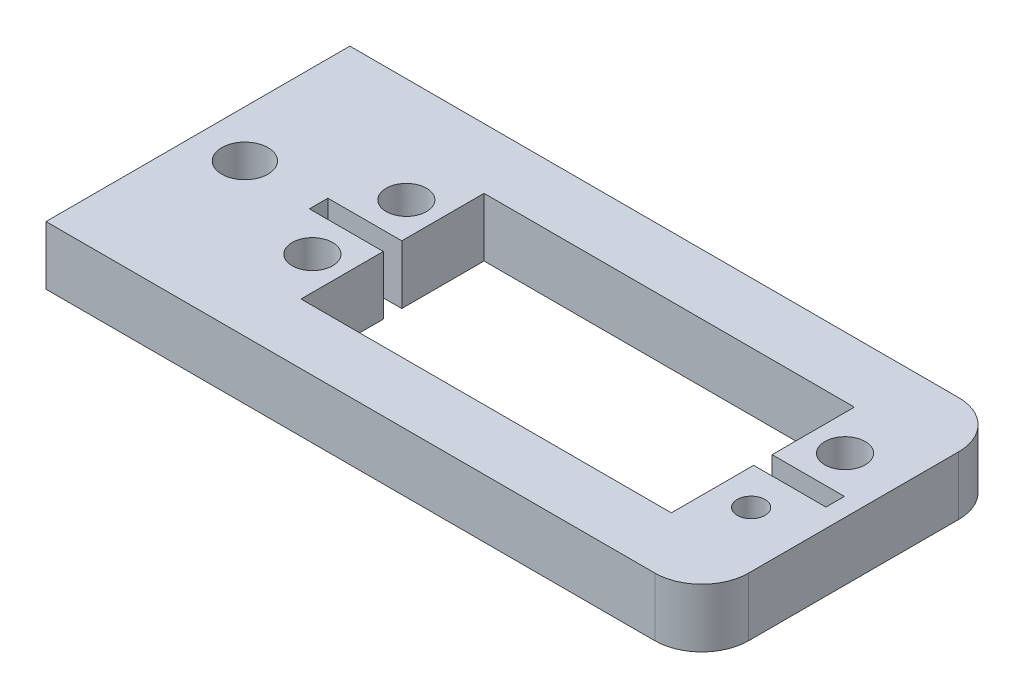
from build123d import *

# Parameters (mm, degrees)
SKETCH1_R           = 2.19
SKETCH1_R_2         = 2.5
SKETCH1_R_3         = 1.5
BOSS_EXTRUDE1_DEPTH = 6.35


with BuildPart() as part:
    # Sketch1 → Boss-Extrude1 (new body)
    with BuildSketch(Plane(origin=(0, 0, 0), x_dir=(1, 0, 0), z_dir=(0, 1, 0))):
        with BuildLine():
            Line((-9.153018436, -1.431925443), (-66.073018436, -1.431925443))
            Line((-66.073018436, -1.431925443), (-75.073018436, -1.431925443))
            Line((-75.073018436, -1.431925443), (-75.073018436, -6.511925443))
            Line((-75.073018436, -6.511925443), (-75.073018436, -29.251925443))
            Line((-75.073018436, -29.251925443), (-75.073018436, -34.331925443))
            Line((-75.073018436, -34.331925443), (-66.073018436, -34.331925443))
            Line((-66.073018436, -34.331925443), (-9.153018436, -34.331925443))
            ThreePointArc((-9.153018436, -34.331925443), (-5.560915987, -32.844027891), (-4.073018436, -29.251925443))
            Line((-4.073018436, -29.251925443), (-4.073018436, -6.511925443))
            ThreePointArc((-4.073018436, -6.511925443), (-5.560915987, -2.919822995), (-9.153018436, -1.431925443))
        make_face()
        with Locations(Location((-57.593170924, -22.966925443, 0), (0, 0, 270))):
            Circle(SKETCH1_R, mode=Mode.SUBTRACT)
        with Locations(Location((-57.593170924, -12.796925443, 0), (0, 0, 90))):
            Circle(SKETCH1_R, mode=Mode.SUBTRACT)
        with Locations(Location((-10.093170924, -12.796925443, 0), (0, 0, 270))):
            Circle(SKETCH1_R, mode=Mode.SUBTRACT)
        with Locations(Location((-69.991443077, -17.881925443, 0), (0, 0, 270))):
            Circle(SKETCH1_R_2, mode=Mode.SUBTRACT)
        with Locations(Location((-10.093170924, -22.966925443, 0), (0, 0, 90))):
            Circle(SKETCH1_R_3, mode=Mode.SUBTRACT)
        Polygon((-13.903170924, -18.881925443), (-13.903170924, -27.791925443), (-54.003170924, -27.791925443), (-54.003170924, -18.881925443), (-62.003170924, -18.881925443), (-62.003170924, -16.881925443), (-54.003170924, -16.881925443), (-54.003170924, -7.971925443), (-13.903170924, -7.971925443), (-13.903170924, -16.881925443), (-6.073018436, -16.881925443), (-6.073018436, -18.881925443), align=None, mode=Mode.SUBTRACT)
    extrude(amount=BOSS_EXTRUDE1_DEPTH)


solid = part.part
